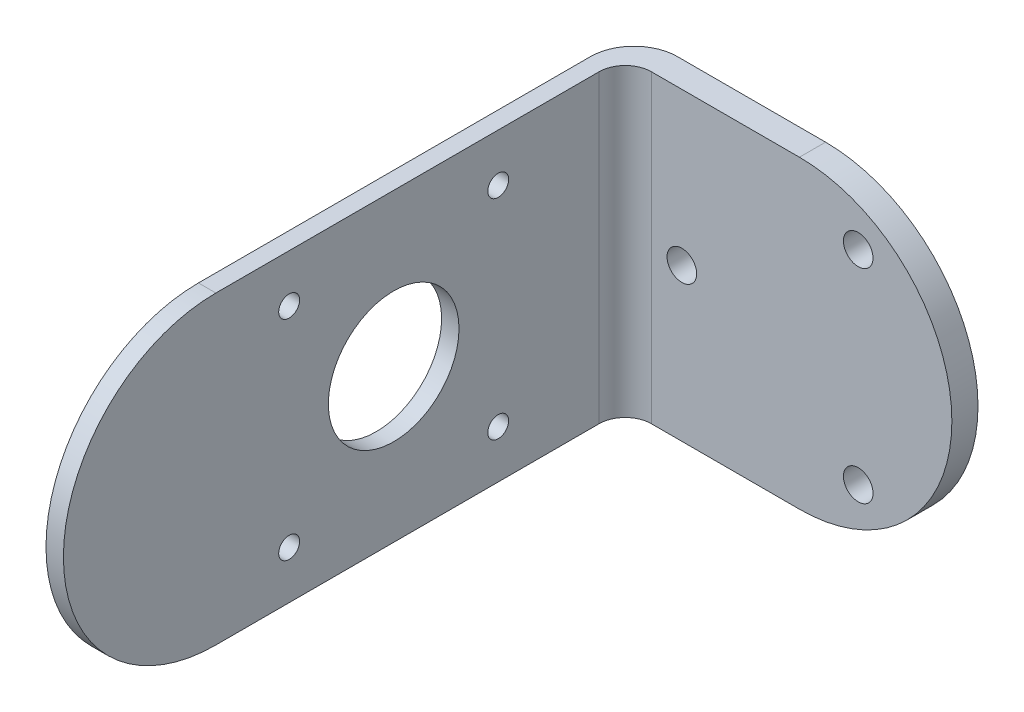
from build123d import *
from OCP.BRepFilletAPI import BRepFilletAPI_MakeFillet

# Parameters (mm, degrees)
SKETCH_1_R          = 1.7
EXTRUDE_1_DEPTH     = 3
EXTRUDE_2_DEPTH     = 2
FILLET_1_R1         = 3
FILLET_1_R2         = 5
SKETCH_3_R          = 1.2
SKETCH_3_R_2        = 7.5
CUT_EXTRUDE_1_DEPTH = 3


with BuildPart() as part:
    # 草图1 → 凸台-拉伸1 (new body)
    with BuildSketch(Plane.XY):
        with BuildLine():
            Line((0, 17.5), (-20, 17.5))
            Line((-20, 17.5), (-20, -17.5))
            Line((-20, -17.5), (0, -17.5))
            ThreePointArc((0, -17.5), (17.5, 0), (0, 17.5))
        make_face()
        with Locations((-13.5, 0)):
            Circle(SKETCH_1_R, mode=Mode.SUBTRACT)
        with Locations((6.75, 11.691342951)):
            Circle(SKETCH_1_R, mode=Mode.SUBTRACT)
        with Locations((6.75, -11.691342951)):
            Circle(SKETCH_1_R, mode=Mode.SUBTRACT)
    extrude(amount=EXTRUDE_1_DEPTH)

    # 草图2 → 凸台-拉伸2 (add)
    with BuildSketch(Plane.ZY.offset(20)):
        with BuildLine():
            Line((0, -17.5), (50, -17.5))
            ThreePointArc((50, -17.5), (67.5, 0), (50, 17.5))
            Line((50, 17.5), (0, 17.5))
            Line((0, 17.5), (0, -17.5))
        make_face()
    extrude(amount=EXTRUDE_2_DEPTH)

    # 圆角1: one fillet with a radius per group of edges: ONE call of the kernel's fillet builder (fillet() takes one radius for all edges)
    fillet_1_edges_1 = [part.edges().sort_by_distance(p)[0] for p in [
        (-20, 0, 3),
    ]]
    fillet_1_edges_2 = [part.edges().sort_by_distance(p)[0] for p in [
        (-22, 0, 0),
    ]]
    fillet_1 = BRepFilletAPI_MakeFillet(part.part.solid().wrapped)
    for e in fillet_1_edges_1:
        fillet_1.Add(FILLET_1_R1, e.wrapped)
    for e in fillet_1_edges_2:
        fillet_1.Add(FILLET_1_R2, e.wrapped)
    add(Compound.cast(fillet_1.Shape()), mode=Mode.REPLACE)

    # 草图3 → 切除-拉伸1 (cut)
    with BuildSketch(Plane(origin=(-20, 0, 0), x_dir=(0, 0, -1), z_dir=(1, 0, 0))):
        with Locations((-41.583465403, -12)):
            Circle(SKETCH_3_R)
        with Locations((-17.583465403, -12)):
            Circle(SKETCH_3_R)
        with Locations((-17.583465403, 12)):
            Circle(SKETCH_3_R)
        with Locations((-41.583465403, 12)):
            Circle(SKETCH_3_R)
        with Locations((-29.583465403, 0)):
            Circle(SKETCH_3_R_2)
    extrude(amount=-CUT_EXTRUDE_1_DEPTH, mode=Mode.SUBTRACT)


solid = part.part
